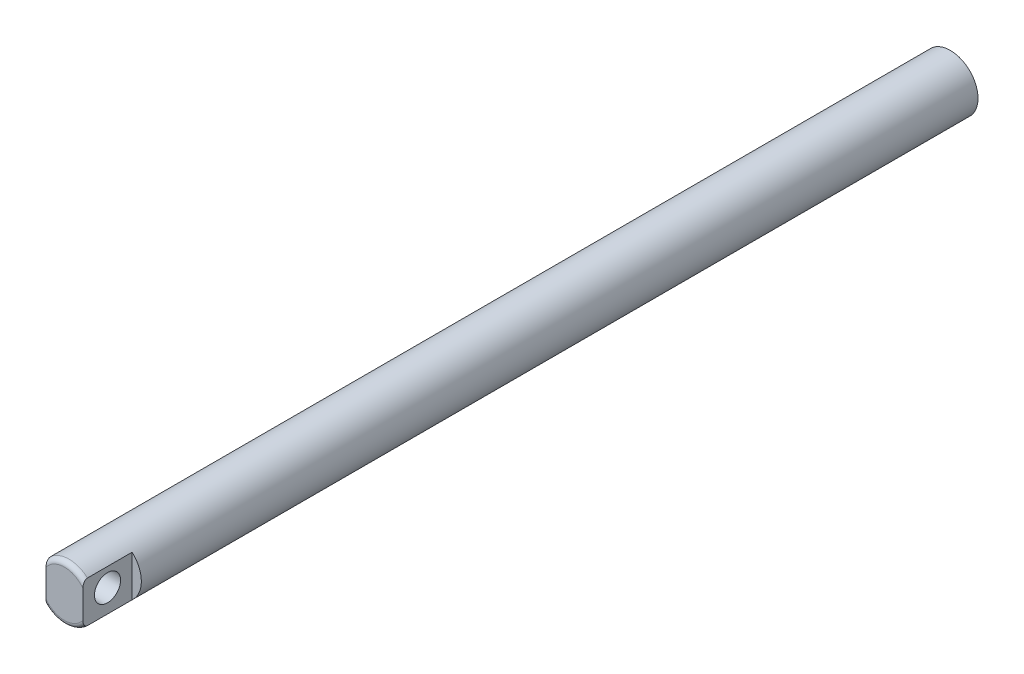
from build123d import *

# Parameters (mm, degrees)
SKETCH1_R               = 4.5
BOSS_EXTRUDE1_DEPTH     = 144
CUT_EXTRUDE1_START      = -3
SKETCH3_W               = 8
SKETCH3_H               = 9
CUT_EXTRUDE1_DEPTH      = 1.5
FILLET1_R               = 0.75
CUT_EXTRUDE2_DEPTH      = 145.265380565
CUT_EXTRUDE2_DEPTH_BACK = 145.265380565
SKETCH4_R               = 2.125


with BuildPart() as part:
    # Sketch1 → Boss-Extrude1 (new body)
    with BuildSketch(Plane.XY):
        Circle(SKETCH1_R)
    extrude(amount=BOSS_EXTRUDE1_DEPTH)

    # Sketch3 → Cut-Extrude1 (cut)
    with BuildSketch(Plane(origin=(0, 0, 0), x_dir=(0, 0, -1), z_dir=(1, 0, 0)).offset(CUT_EXTRUDE1_START)):
        with Locations((-140, 0)):
            Rectangle(SKETCH3_W, SKETCH3_H)
    cut_extrude1 = extrude(amount=-CUT_EXTRUDE1_DEPTH, mode=Mode.SUBTRACT)

    # Mirror1: Cut-Extrude1 across plane
    add(cut_extrude1.mirror(Plane(origin=(0, 0, 0), x_dir=(0, 0, 1), z_dir=(1, 0, 0))), mode=Mode.SUBTRACT)

    # Fillet1
    fillet1_edges = [part.edges().sort_by_distance(p)[0] for p in [
        (0, 4.5, 144),
        (0, -4.5, 144),
    ]]
    fillet(fillet1_edges, radius=FILLET1_R)

    # Sketch4 → Cut-Extrude2 (cut, two sides: drawn at the far end of the back side and taken through both)
    with BuildSketch(Plane(origin=(3, 0, 0), x_dir=(0, 0, -1), z_dir=(1, 0, 0)).offset(-CUT_EXTRUDE2_DEPTH_BACK)):
        with Locations((-140, 0.354101966)):
            Circle(SKETCH4_R)
    extrude(amount=CUT_EXTRUDE2_DEPTH + CUT_EXTRUDE2_DEPTH_BACK, mode=Mode.SUBTRACT)


solid = part.part
